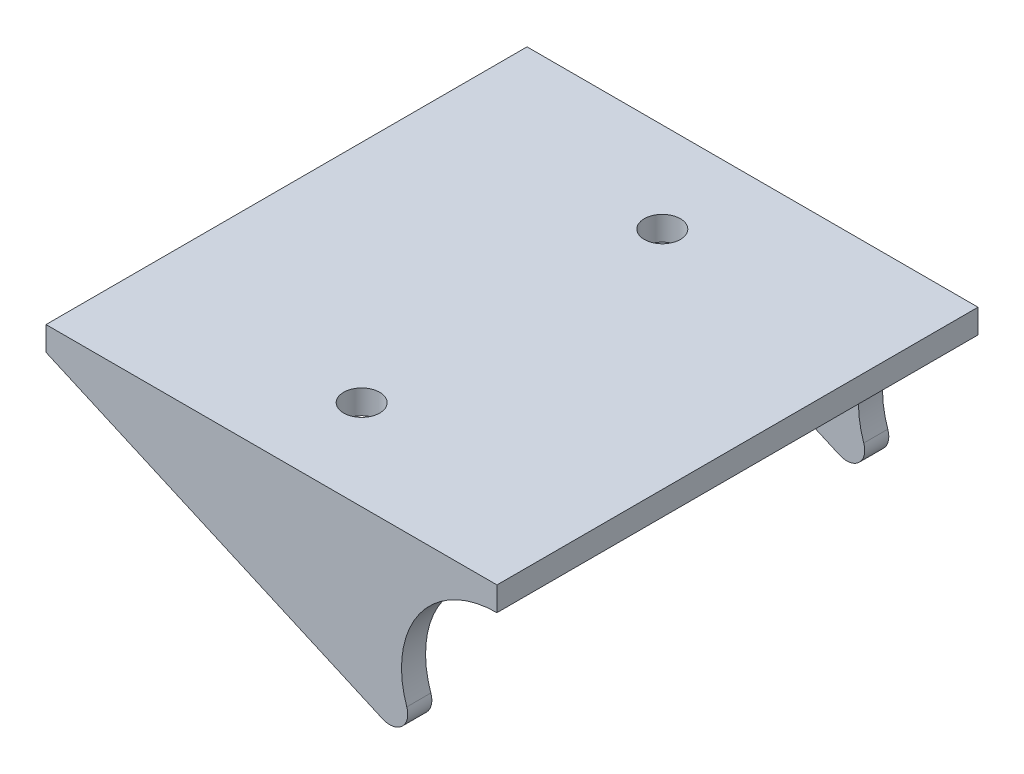
from build123d import *

# Parameters (mm, degrees)
BOSS_EXTRUDE1_DEPTH = 4
SKETCH2_W           = 75
SKETCH2_H           = 4
BOSS_EXTRUDE2_DEPTH = 72
BOSS_EXTRUDE3_DEPTH = 4
SKETCH5_R           = 3
CUT_EXTRUDE1_DEPTH  = 4
FILLET1_R           = 3


with BuildPart() as part:
    # Sketch1 → Boss-Extrude1 (new body)
    with BuildSketch(Plane.XY):
        with BuildLine():
            Line((0, 15.875), (0, 19.875))
            Line((0, 19.875), (-75, 19.875))
            Line((-75, 19.875), (-75, 15.875))
            Line((-75, 15.875), (-6.432235, -14.51351))
            ThreePointArc((-6.432235, -14.51351), (-15.530898, 3.287373), (0, 15.875))
        make_face()
    extrude(amount=BOSS_EXTRUDE1_DEPTH)

    # Sketch2 → Boss-Extrude2 (add)
    with BuildSketch(Plane.XY.offset(4)):
        with Locations((-37.5, 17.875)):
            Rectangle(SKETCH2_W, SKETCH2_H)
    extrude(amount=BOSS_EXTRUDE2_DEPTH)

    # Sketch4 → Boss-Extrude3 (add)
    with BuildSketch(Plane.XY.offset(76)):
        with BuildLine():
            Line((-75, 19.875), (-75, 15.875))
            Line((-75, 15.875), (-6.432235, -14.51351))
            ThreePointArc((-6.432235, -14.51351), (-15.530898, 3.287373), (0, 15.875))
            Line((0, 15.875), (0, 19.875))
            Line((0, 19.875), (-75, 19.875))
        make_face()
    extrude(amount=BOSS_EXTRUDE3_DEPTH)

    # Sketch5 → Cut-Extrude1 (cut)
    with BuildSketch(Plane(origin=(0, 19.875, 0), x_dir=(1, 0, 0), z_dir=(0, 1, 0))):
        with Locations(Location((-37.5, -15, 0), (0, 0, 270))):
            Circle(SKETCH5_R)
        with Locations(Location((-37.5, -65, 0), (0, 0, 270))):
            Circle(SKETCH5_R)
    extrude(amount=-CUT_EXTRUDE1_DEPTH, mode=Mode.SUBTRACT)

    # Fillet1
    fillet1_edges = [part.edges().sort_by_distance(p)[0] for p in [
        (-6.432235, -14.51351, 78),
        (-6.432235, -14.51351, 2),
    ]]
    fillet(fillet1_edges, radius=FILLET1_R)


solid = part.part
